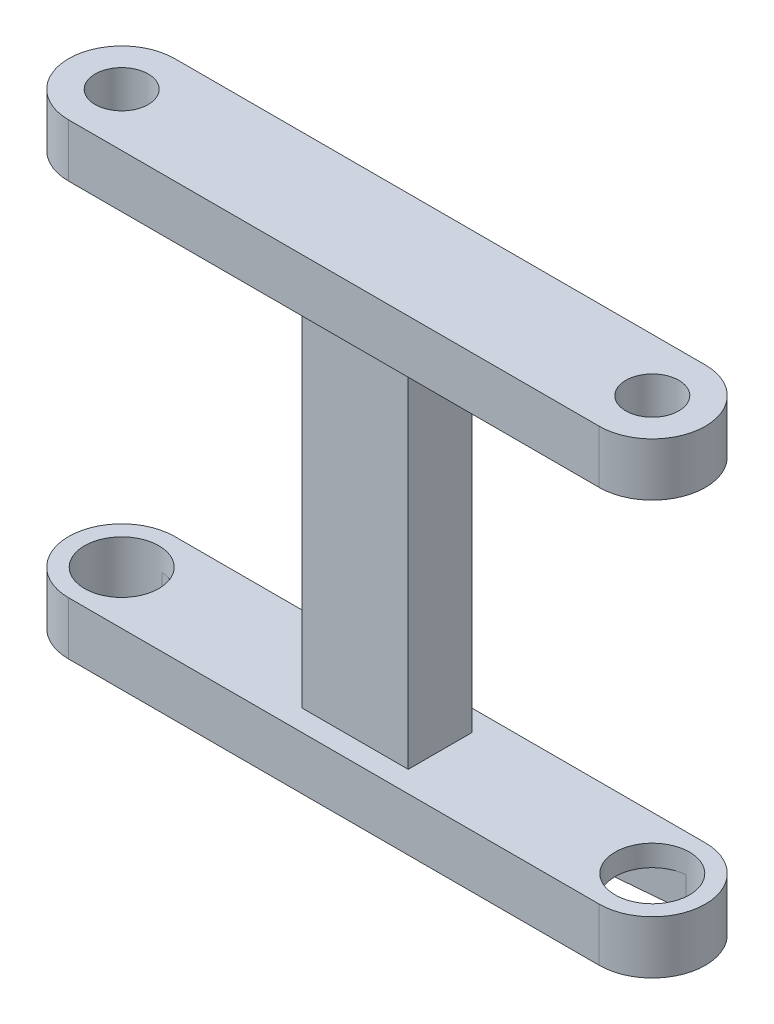
from build123d import *

# Parameters (mm, degrees)
SKETCH2_W           = 60
SKETCH2_H           = 10
BOSS_EXTRUDE1_DEPTH = 5
FILLET1_RADIUS      = 5
FILLET1_LENGTH      = 5
FILLET2_RADIUS      = 5
FILLET2_LENGTH      = 5
SKETCH11_W          = 4.99996664
SKETCH11_H          = 10
BOSS_EXTRUDE3_DEPTH = 34
SKETCH12_W          = 2
SKETCH12_H          = 34
CUT_EXTRUDE6_DEPTH  = 18
BOSS_EXTRUDE4_DEPTH = 5
SKETCH14_R          = 2.5
CUT_EXTRUDE7_DEPTH  = 5
SKETCH15_R          = 3.5
CUT_EXTRUDE8_DEPTH  = 5
CUT_EXTRUDE10_DEPTH = 3


with BuildPart() as part:
    # Sketch2 → Boss-Extrude1 (new body)
    with BuildSketch(Plane(origin=(0, 0, 0), x_dir=(1, 0, 0), z_dir=(0, 1, 0))):
        Rectangle(SKETCH2_W, SKETCH2_H)
    extrude(amount=BOSS_EXTRUDE1_DEPTH)

    # Fillet1: full round fillet: the end face becomes a half cylinder, R = half its width
    fillet1_face = Plane((-30, 2.5, 0), x_dir=(0, 1, 0), z_dir=(-1, 0, 0))  # on the end face: x along it, z out of the body
    fillet1_slab = fillet1_face.offset(-FILLET1_RADIUS / 2) * Box(FILLET1_LENGTH, 2 * FILLET1_RADIUS, FILLET1_RADIUS, mode=Mode.PRIVATE)  # the body's end, R deep
    fillet1_round = Plane((-25, 2.5, 0), x_dir=(-1, 0, 0), z_dir=(0, 1, 0)) * Cylinder(FILLET1_RADIUS, FILLET1_LENGTH, mode=Mode.PRIVATE)  # its axis R under the face
    add(fillet1_slab - fillet1_round, mode=Mode.SUBTRACT)

    # Fillet2: full round fillet: the end face becomes a half cylinder, R = half its width
    fillet2_face = Plane((30, 2.5, 0), x_dir=(0, -1, 0), z_dir=(1, 0, 0))  # on the end face: x along it, z out of the body
    fillet2_slab = fillet2_face.offset(-FILLET2_RADIUS / 2) * Box(FILLET2_LENGTH, 2 * FILLET2_RADIUS, FILLET2_RADIUS, mode=Mode.PRIVATE)  # the body's end, R deep
    fillet2_round = Plane((25, 2.5, 0), x_dir=(1, 0, 0), z_dir=(0, -1, 0)) * Cylinder(FILLET2_RADIUS, FILLET2_LENGTH, mode=Mode.PRIVATE)  # its axis R under the face
    add(fillet2_slab - fillet2_round, mode=Mode.SUBTRACT)

    # Sketch11 → Boss-Extrude3 (add)
    with BuildSketch(Plane(origin=(0, 5, 0), x_dir=(1, 0, 0), z_dir=(0, 1, 0))):
        with Locations((2.49998332, 0)):
            Rectangle(SKETCH11_W, SKETCH11_H)
        Polygon((0, -5), (0, 5), (-4.99996664, 4.981735201), (-4.99996664, -5), align=None)
    extrude(amount=BOSS_EXTRUDE3_DEPTH)

    # Sketch12 → Cut-Extrude6 (cut)
    with BuildSketch(Plane(origin=(4.99996664, 0, 0), x_dir=(0, 0, -1), z_dir=(1, 0, 0))):
        with Locations((-4, 22)):
            Rectangle(SKETCH12_W, SKETCH12_H)
        with Locations((4, 22)):
            Rectangle(SKETCH12_W, SKETCH12_H)
    extrude(amount=-CUT_EXTRUDE6_DEPTH, mode=Mode.SUBTRACT)

    # Sketch13 → Boss-Extrude4 (add)
    with BuildSketch(Plane(origin=(0, 39, 0), x_dir=(1, 0, 0), z_dir=(0, 1, 0))):
        with BuildLine():
            Line((25, 5), (-25, 5))
            ThreePointArc((-25, 5), (-30, 0), (-25, -5))
            Line((-25, -5), (25, -5))
            ThreePointArc((25, -5), (30, 0), (25, 5))
        make_face()
    extrude(amount=BOSS_EXTRUDE4_DEPTH)

    # Sketch14 → Cut-Extrude7 (cut)
    with BuildSketch(Plane(origin=(0, 44, 0), x_dir=(1, 0, 0), z_dir=(0, 1, 0))):
        with Locations(Location((-25, 0, 0), (0, 0, 270))):
            Circle(SKETCH14_R)
        with Locations(Location((25, 0, 0), (0, 0, 90))):
            Circle(SKETCH14_R)
    extrude(amount=-CUT_EXTRUDE7_DEPTH, mode=Mode.SUBTRACT)

    # Sketch15 → Cut-Extrude8 (cut)
    with BuildSketch(Plane.XZ):
        with Locations(Location((-25, 0, 0), (0, 0, 270))):
            Circle(SKETCH15_R)
        with Locations(Location((25, 0, 0), (0, 0, 270))):
            Circle(SKETCH15_R)
    extrude(amount=-CUT_EXTRUDE8_DEPTH, mode=Mode.SUBTRACT)

    # Sketch18 → Cut-Extrude10 (cut)
    with BuildSketch(Plane.XZ):
        with BuildLine():
            ThreePointArc((-24.695652174, 3.486742377), (-21.5, 0), (-24.695652174, -3.486742377))
            Line((-24.695652174, -3.486742377), (-8.717391304, -2.092045426))
            ThreePointArc((-8.717391304, -2.092045426), (-6.8, 0), (-8.717391304, 2.092045426))
            Line((-8.717391304, 2.092045426), (-24.695652174, 3.486742377))
        make_face()
        with BuildLine():
            Line((8.717391304, -2.092045426), (24.695652174, -3.486742377))
            ThreePointArc((24.695652174, -3.486742377), (21.5, 0), (24.695652174, 3.486742377))
            Line((24.695652174, 3.486742377), (8.717391304, 2.092045426))
            ThreePointArc((8.717391304, 2.092045426), (6.8, 0), (8.717391304, -2.092045426))
        make_face()
    extrude(amount=-CUT_EXTRUDE10_DEPTH, mode=Mode.SUBTRACT)


solid = part.part
